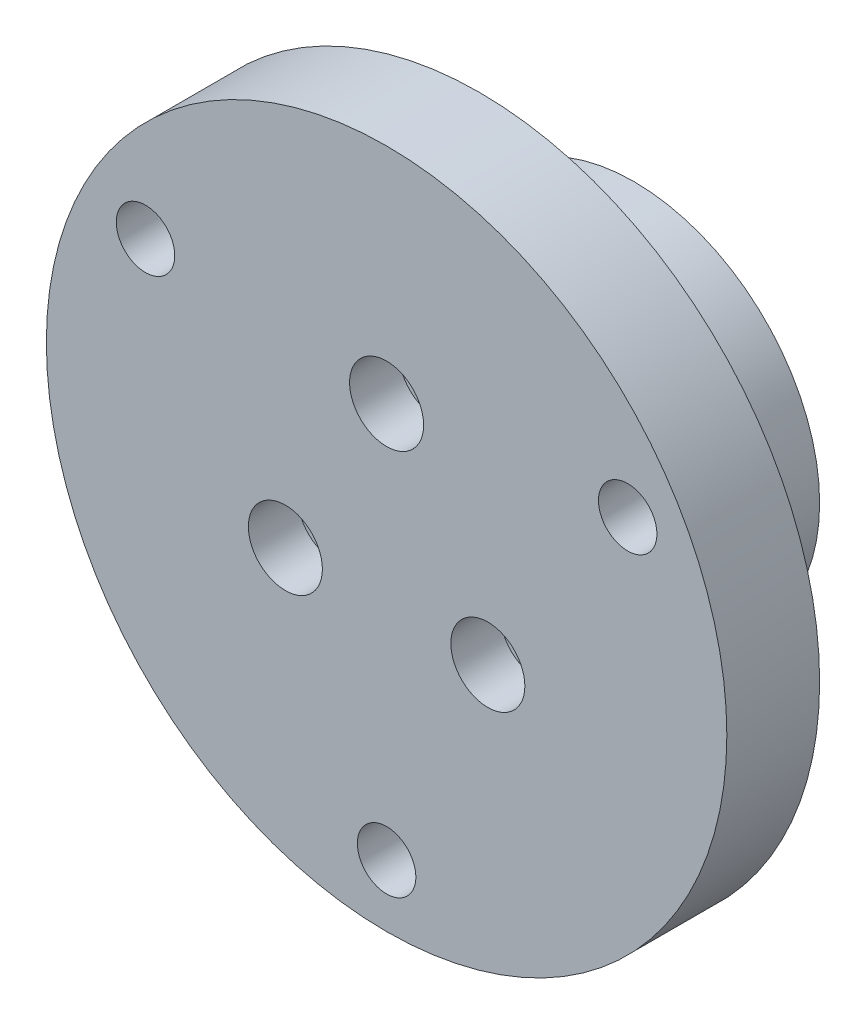
from build123d import *

# Parameters (mm, degrees)
SKETCH1_R            = 9.525
BOSS_EXTRUDE1_DEPTH  = 12.7
SKETCH9_R            = 17.4625
BOSS_EXTRUDE2_DEPTH  = 4.7625
SKETCH2_R            = 4.572
CUT_EXTRUDE1_DEPTH   = 2.9972
M2_CLEARANCE_HOLE1_D = 2.4
SKETCH6_R            = 1.9
CUT_EXTRUDE2_DEPTH   = 2.54
SKETCH7_R            = 1.499997
CUT_EXTRUDE3_DEPTH   = 28.769908399
CIRPATTERN1_COUNT    = 3
CIRPATTERN2_COUNT    = 3
FILLET1_R            = 1.5875


with BuildPart() as part:
    # Sketch1 → Boss-Extrude1 (new body)
    with BuildSketch(Plane.XY):
        Circle(SKETCH1_R)
    extrude(amount=BOSS_EXTRUDE1_DEPTH)

    # Sketch9 → Boss-Extrude2 (add)
    with BuildSketch(Plane.XY.offset(12.7)):
        Circle(SKETCH9_R)
    extrude(amount=-BOSS_EXTRUDE2_DEPTH)

    # Sketch2 → Cut-Extrude1 (cut)
    with BuildSketch(Plane(origin=(0, 0, 0), x_dir=(-1, 0, 0), z_dir=(0, 0, -1))):
        Circle(SKETCH2_R)
    extrude(amount=-CUT_EXTRUDE1_DEPTH, mode=Mode.SUBTRACT)

    # M2 Clearance Hole1 (through all)
    with Locations(Plane(origin=(0, 0, 0), x_dir=(-1, 0, 0), z_dir=(0, 0, -1))):
        with Locations((0, 6.0000007)):
            m2_clearance_hole1 = Hole(M2_CLEARANCE_HOLE1_D / 2)

    # Sketch6 → Cut-Extrude2 (cut)
    with BuildSketch(Plane.XY.offset(12.7)):
        with Locations((0, 6.0000007)):
            Circle(SKETCH6_R)
    cut_extrude2 = extrude(amount=-CUT_EXTRUDE2_DEPTH, mode=Mode.SUBTRACT)

    # Sketch7 → Cut-Extrude3 (cut, through all)
    with BuildSketch(Plane(origin=(0, 0, 0), x_dir=(-1, 0, 0), z_dir=(0, 0, -1))):
        with Locations((12.373337957, 7.14375)):
            Circle(SKETCH7_R)
    cut_extrude3 = extrude(amount=-CUT_EXTRUDE3_DEPTH, mode=Mode.SUBTRACT)

    # CirPattern1: M2 Clearance Hole1, Cut-Extrude2 ×3 about axis
    cirpattern1_axis = Axis((0, 0, 0), (0, 0, 1))
    add([m2_clearance_hole1.rotate(cirpattern1_axis, i * 360 / CIRPATTERN1_COUNT) for i in range(1, CIRPATTERN1_COUNT)], mode=Mode.SUBTRACT)
    add([cut_extrude2.rotate(cirpattern1_axis, i * 360 / CIRPATTERN1_COUNT) for i in range(1, CIRPATTERN1_COUNT)], mode=Mode.SUBTRACT)

    # CirPattern2: Cut-Extrude3 ×3 about axis
    cirpattern2_axis = Axis((0, 0, 0), (0, 0, 1))
    for i in range(1, CIRPATTERN2_COUNT):
        add(cut_extrude3.rotate(cirpattern2_axis, i * 360 / CIRPATTERN2_COUNT), mode=Mode.SUBTRACT)

    # Fillet1
    fillet1_edges = [part.edges().sort_by_distance(p)[0] for p in [
        (-9.525, 0, 7.9375),
    ]]
    fillet(fillet1_edges, radius=FILLET1_R)


solid = part.part
